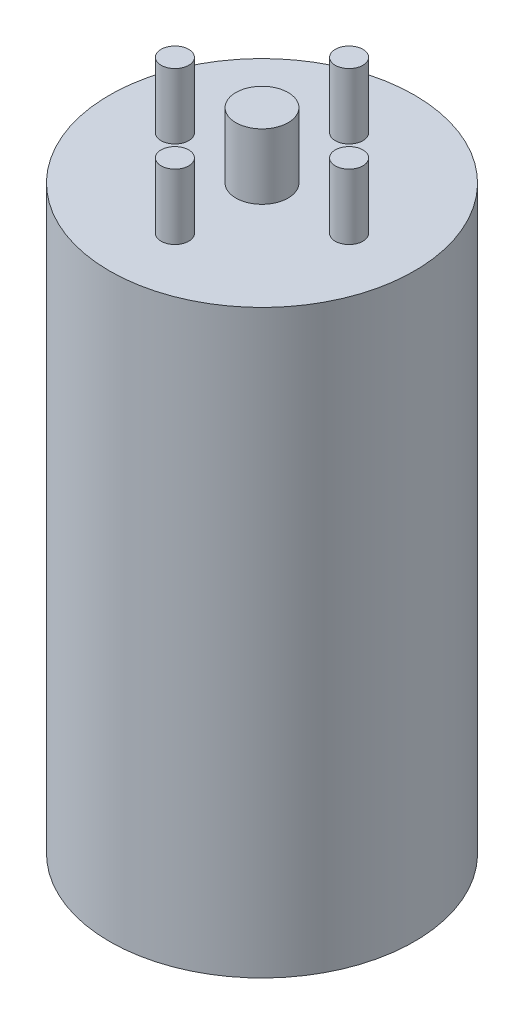
from build123d import *

# Parameters (mm, degrees)
SKETCH1_R           = 14
BOSS_EXTRUDE1_DEPTH = 53.34
SKETCH2_R           = 2.4
SKETCH2_R_2         = 1.27
BOSS_EXTRUDE2_DEPTH = 6


with BuildPart() as part:
    # Sketch1 → Boss-Extrude1 (new body)
    with BuildSketch(Plane(origin=(0, 0, 0), x_dir=(1, 0, 0), z_dir=(0, 1, 0))):
        with Locations(Location((0, 0, 0), (0, 0, 270))):
            Circle(SKETCH1_R)
    extrude(amount=BOSS_EXTRUDE1_DEPTH)

    # Sketch2 → Boss-Extrude2 (add)
    with BuildSketch(Plane(origin=(0, 53.34, 0), x_dir=(1, 0, 0), z_dir=(0, 1, 0))):
        with Locations(Location((0, 0, 0), (0, 0, 270))):
            Circle(SKETCH2_R)
        with Locations(Location((8, 0, 0), (0, 0, 270))):
            Circle(SKETCH2_R_2)
        with Locations(Location((0, -8, 0), (0, 0, 270))):
            Circle(SKETCH2_R_2)
        with Locations(Location((-8, 0, 0), (0, 0, 270))):
            Circle(SKETCH2_R_2)
        with Locations(Location((0, 8, 0), (0, 0, 270))):
            Circle(SKETCH2_R_2)
    extrude(amount=BOSS_EXTRUDE2_DEPTH)


solid = part.part
